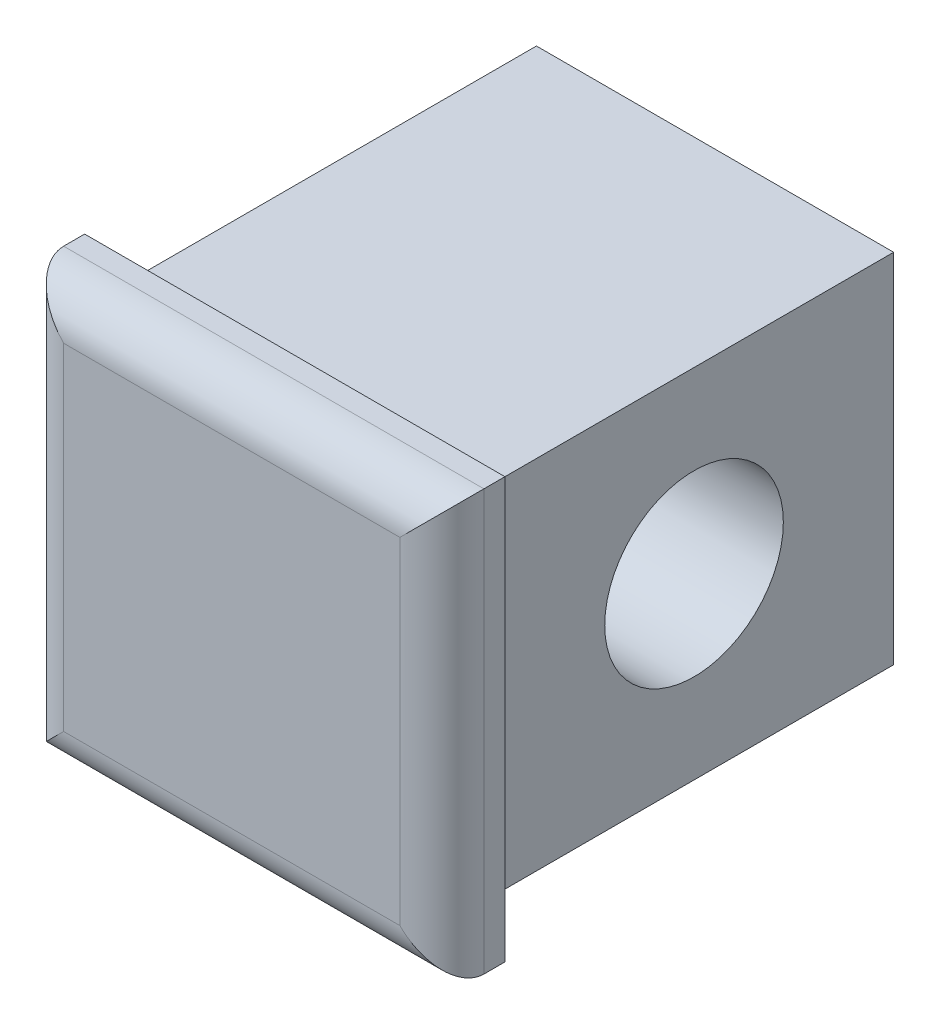
from build123d import *

# Parameters (mm, degrees)
SKETCH1_W           = 3
SKETCH1_H           = 20
BOSS_EXTRUDE1_DEPTH = 10
SKETCH2_W           = 17
SKETCH2_H           = 17
BOSS_EXTRUDE2_DEPTH = 20
SKETCH3_R           = 4.25
CUT_EXTRUDE1_DEPTH  = 30.021543722
FILLET1_R           = 2


with BuildPart() as part:
    # Sketch1 → Boss-Extrude1 (new, symmetric)
    with BuildSketch(Plane(origin=(0, 0, 0), x_dir=(0, 0, -1), z_dir=(1, 0, 0))):
        with Locations((-1.5, 0)):
            Rectangle(SKETCH1_W, SKETCH1_H)
    extrude(amount=BOSS_EXTRUDE1_DEPTH, both=True)

    # Sketch2 → Boss-Extrude2 (add)
    with BuildSketch(Plane(origin=(0, 0, 0), x_dir=(-1, 0, 0), z_dir=(0, 0, -1))):
        Rectangle(SKETCH2_W, SKETCH2_H)
    extrude(amount=BOSS_EXTRUDE2_DEPTH)

    # Sketch3 → Cut-Extrude1 (cut, through all)
    with BuildSketch(Plane(origin=(8.5, 0, 0), x_dir=(0, 0, -1), z_dir=(1, 0, 0))):
        with Locations((10.5, 0)):
            Circle(SKETCH3_R)
    extrude(amount=-CUT_EXTRUDE1_DEPTH, mode=Mode.SUBTRACT)

    # Fillet1
    fillet1_edges = [part.edges().sort_by_distance(p)[0] for p in [
        (-10, 0, 3),
        (0, -10, 3),
        (0, 10, 3),
        (10, 0, 3),
    ]]
    fillet(fillet1_edges, radius=FILLET1_R)


solid = part.part
